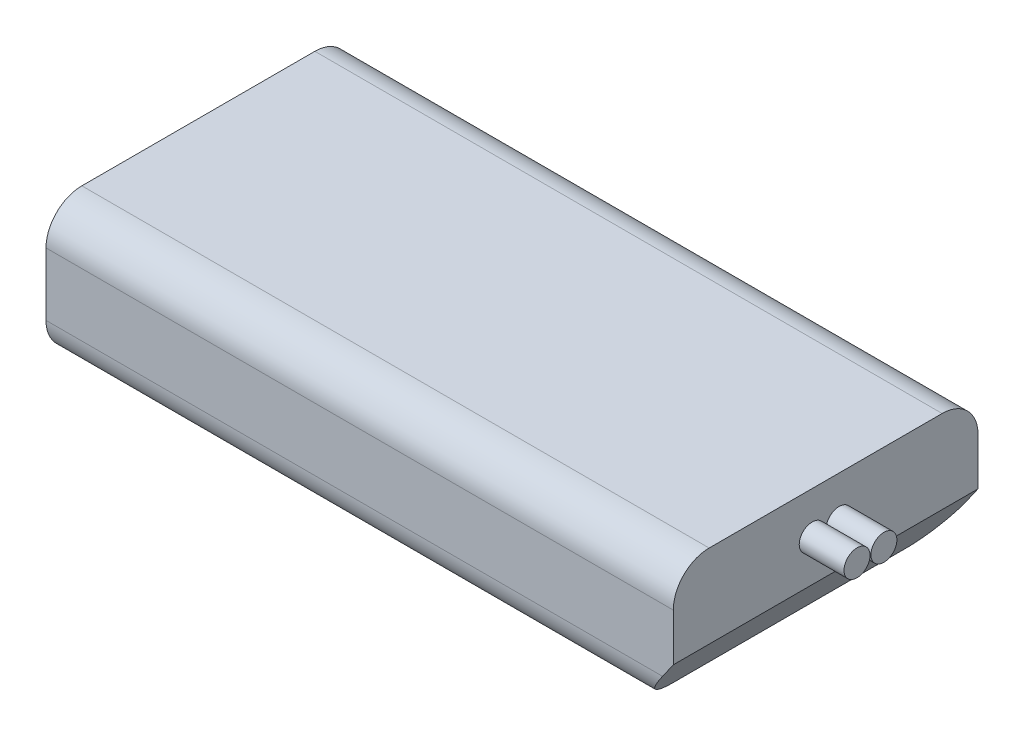
from build123d import *

# Parameters (mm, degrees)
SKETCH1_W           = 35
SKETCH1_H           = 17
BOSS_EXTRUDE1_DEPTH = 7.5
CHAMFER1_SIZE       = 2
CHAMFER1_SIZE2      = 2.856296013
FILLET1_R           = 2
SKETCH3_R           = 0.725
BOSS_EXTRUDE2_DEPTH = 2.5


with BuildPart() as part:
    # Sketch1 → Boss-Extrude1 (new body)
    with BuildSketch(Plane(origin=(0, 0, 0), x_dir=(1, 0, 0), z_dir=(0, 1, 0))):
        Rectangle(SKETCH1_W, SKETCH1_H)
    extrude(amount=BOSS_EXTRUDE1_DEPTH)

    # Chamfer1
    chamfer1_edges = [part.edges().sort_by_distance(p)[0] for p in [
        (17.5, 0, 0),
    ]]
    chamfer1_side = [part.faces().sort_by_distance(p)[0] for p in [
        (0, 0, 0),
    ]]
    chamfer(chamfer1_edges, length=CHAMFER1_SIZE, length2=CHAMFER1_SIZE2, reference=chamfer1_side[0])

    # Fillet1
    fillet1_edges = [part.edges().sort_by_distance(p)[0] for p in [
        (-1, 0, -8.5),
        (0, 7.5, 8.5),
        (-1, 0, 8.5),
        (0, 7.5, -8.5),
    ]]
    fillet(fillet1_edges, radius=FILLET1_R)

    # Sketch3 → Boss-Extrude2 (add)
    with BuildSketch(Plane(origin=(17.5, 0, 0), x_dir=(0, 0, -1), z_dir=(1, 0, 0))):
        with Locations(Location((-0.75, 5.157979839, 0), (0, 0, 180))):
            Circle(SKETCH3_R)
        with Locations(Location((0.75, 5.157979839, 0), (0, 0, 180))):
            Circle(SKETCH3_R)
    extrude(amount=BOSS_EXTRUDE2_DEPTH)


solid = part.part
